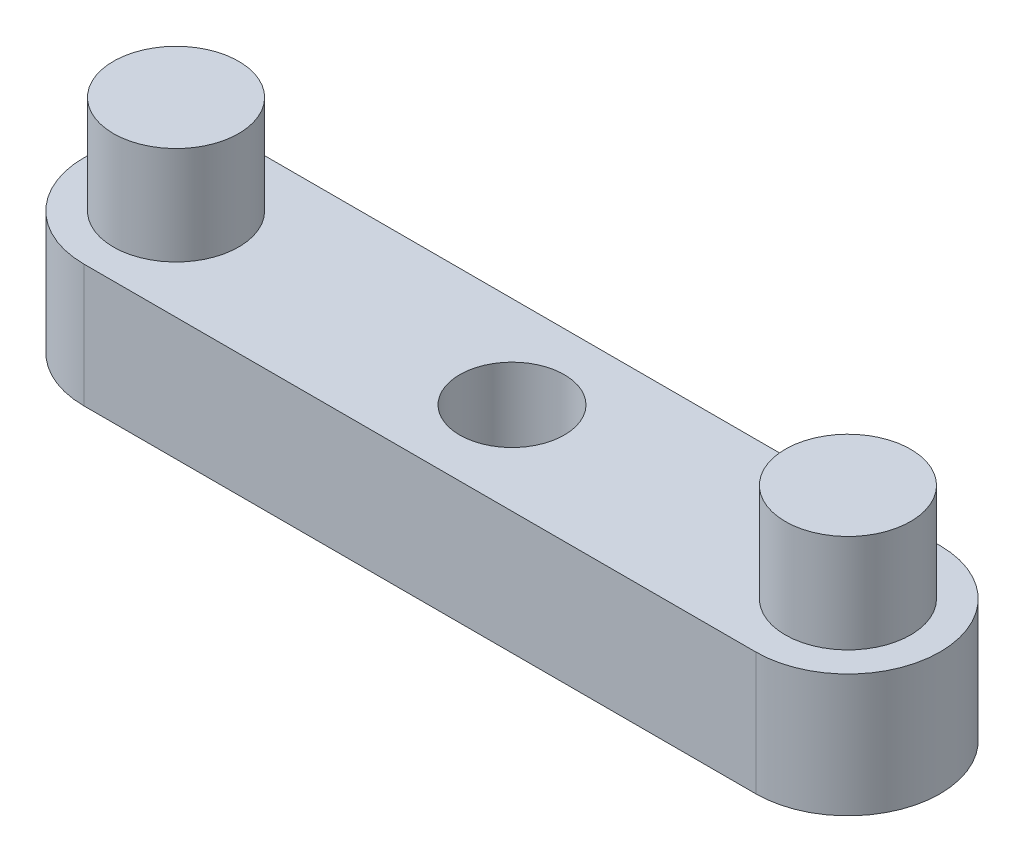
from build123d import *

# Parameters (mm, degrees)
BOSS_EXTRUDE1_DEPTH      = 2.5
BOSS_EXTRUDE1_DEPTH_BACK = 2.5
SKETCH1_R                = 2.13
SKETCH2_R                = 2.55
BOSS_EXTRUDE2_DEPTH      = 4


with BuildPart() as part:
    # Sketch1 → Boss-Extrude1 (new, two sides: drawn at the far end of the back side and taken through both)
    with BuildSketch(Plane(origin=(0, 0, 0), x_dir=(1, 0, 0), z_dir=(0, 1, 0)).offset(-BOSS_EXTRUDE1_DEPTH_BACK)):
        with BuildLine():
            Line((-13.675, 3.75), (13.675, 3.75))
            ThreePointArc((13.675, 3.75), (17.425, 0), (13.675, -3.75))
            Line((13.675, -3.75), (-13.675, -3.75))
            ThreePointArc((-13.675, -3.75), (-17.425, 0), (-13.675, 3.75))
        make_face()
        Circle(SKETCH1_R, mode=Mode.SUBTRACT)
    extrude(amount=BOSS_EXTRUDE1_DEPTH + BOSS_EXTRUDE1_DEPTH_BACK)

    # Sketch2 → Boss-Extrude2 (add)
    with BuildSketch(Plane(origin=(0, 2.5, 0), x_dir=(1, 0, 0), z_dir=(0, 1, 0))):
        with Locations((-13.675, 0)):
            Circle(SKETCH2_R)
        with Locations((13.675, 0)):
            Circle(SKETCH2_R)
    extrude(amount=BOSS_EXTRUDE2_DEPTH)


solid = part.part
